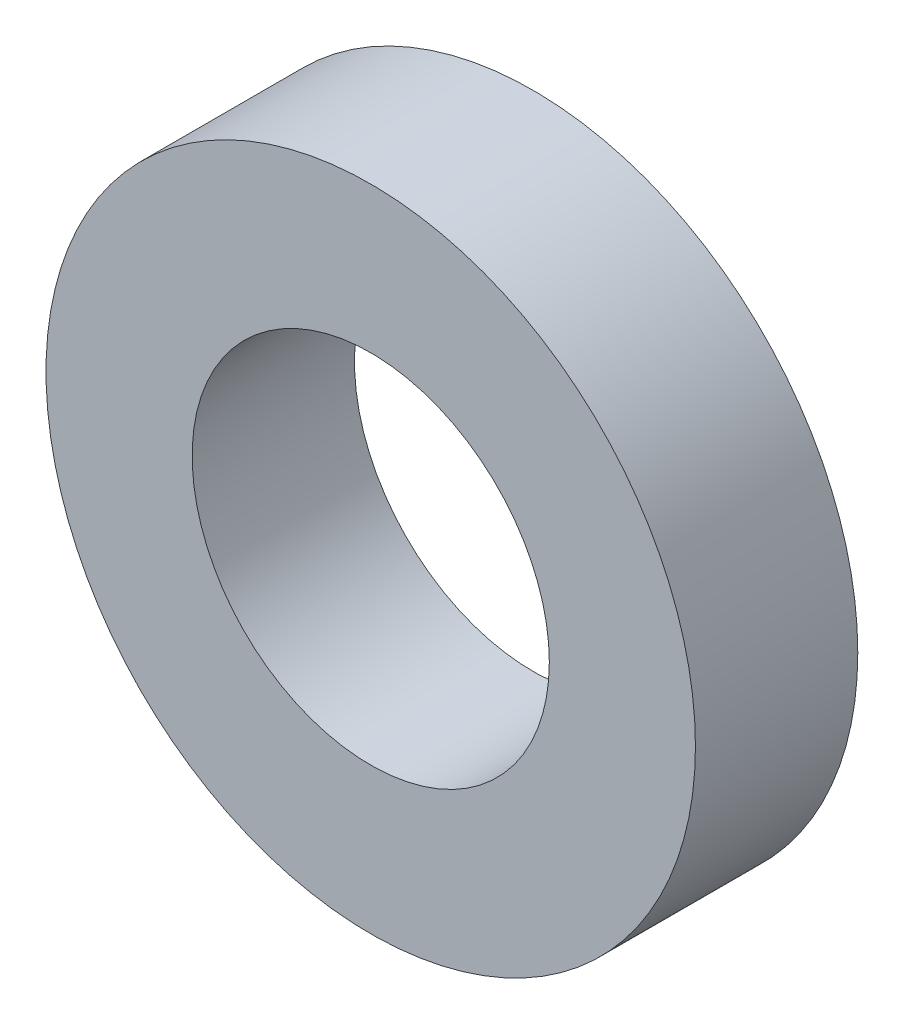
from build123d import *

# Parameters (mm, degrees)
SKETCH1_R    = 2
SKETCH1_R_2  = 1.1
SPACER_DEPTH = 1


with BuildPart() as part:
    # Sketch1 → Spacer (new body)
    with BuildSketch(Plane.XY):
        Circle(SKETCH1_R)
        Circle(SKETCH1_R_2, mode=Mode.SUBTRACT)
    extrude(amount=SPACER_DEPTH)


solid = part.part
